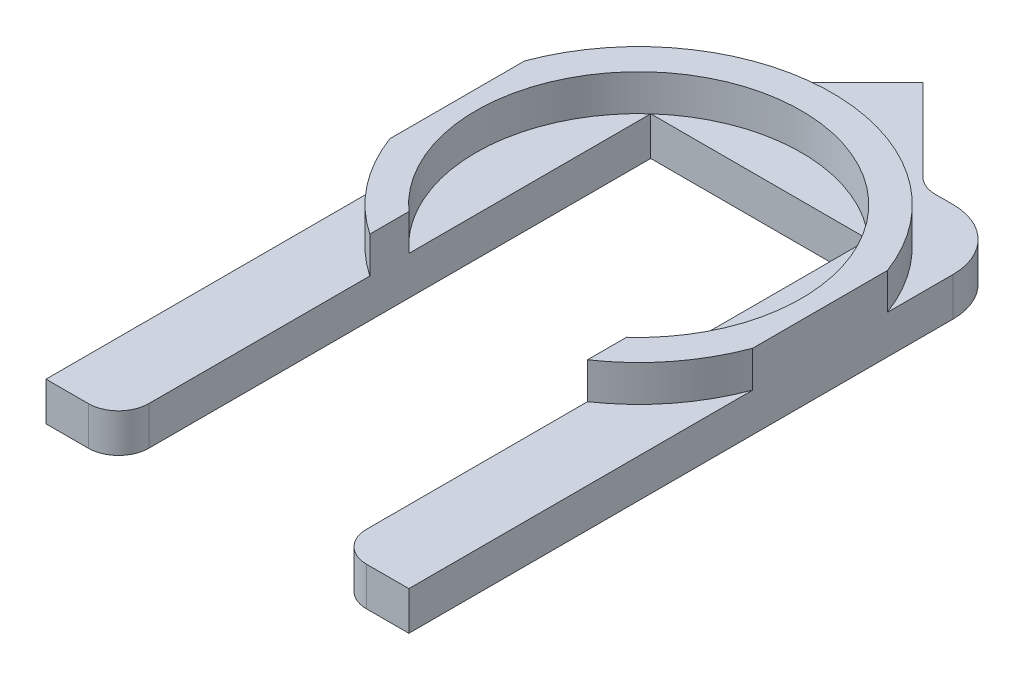
from build123d import *

# Parameters (mm, degrees)
BOSS_EXTRUDE1_DEPTH = 3.2
BOSS_EXTRUDE2_DEPTH = 3
FILLET1_R           = 5
FILLET2_R           = 2.5


with BuildPart() as part:
    # Sketch1 → Boss-Extrude1 (new body)
    with BuildSketch(Plane(origin=(0, 0, 0), x_dir=(1, 0, 0), z_dir=(0, 1, 0))):
        Polygon((-15, -25), (-9, -25), (-9, 19), (9, 19), (9, -25), (15, -25), (15, 25), (7.5, 25), (0, 32.5), (-7.5, 25), (-15, 25), align=None)
    extrude(amount=BOSS_EXTRUDE1_DEPTH)

    # Sketch2 → Boss-Extrude2 (add)
    with BuildSketch(Plane(origin=(0, 3.2, 0), x_dir=(1, 0, 0), z_dir=(0, 1, 0))):
        with BuildLine():
            Line((-9, -4.228756555), (-9, -1))
            ThreePointArc((-9, -1), (0, 22.453624047), (9, -1))
            Line((9, -1), (9, -4.228756555))
            ThreePointArc((9, -4.228756555), (12.596535252, -0.865459931), (15, 3.432235637))
            Line((15, 3.432235637), (15, 14.567764363))
            ThreePointArc((15, 14.567764363), (0, 25), (-15, 14.567764363))
            Line((-15, 14.567764363), (-15, 3.432235637))
            ThreePointArc((-15, 3.432235637), (-12.596535252, -0.865459931), (-9, -4.228756555))
        make_face()
    extrude(amount=BOSS_EXTRUDE2_DEPTH)

    # Fillet1
    fillet1_edges = [part.edges().sort_by_distance(p)[0] for p in [
        (15, 1.6, -25),
        (-15, 1.6, -25),
    ]]
    fillet(fillet1_edges, radius=FILLET1_R)

    # Fillet2
    fillet2_edges = [part.edges().sort_by_distance(p)[0] for p in [
        (-7.5, 1.6, -25),
        (7.5, 1.6, -25),
        (9, 1.6, 25),
        (-9, 1.6, 25),
    ]]
    fillet(fillet2_edges, radius=FILLET2_R)


solid = part.part
